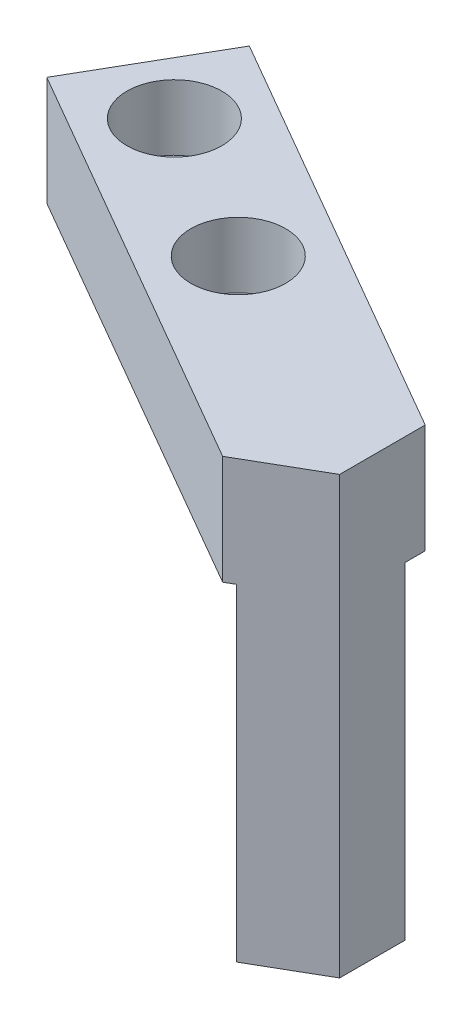
from build123d import *

# Parameters (mm, degrees)
EXTRUDE_1_DEPTH              = 5
EXTRUDE_2_DEPTH              = 15
HOLE_WIZARD_M2_1_D           = 2.35
HOLE_WIZARD_M2_1_DEPTH       = 20
HOLE_WIZARD_M2_1_CBORE_D     = 4.35
HOLE_WIZARD_M2_1_CBORE_DEPTH = 3


with BuildPart() as part:
    # 草圖1 → 填料-伸長1 (new body)
    with BuildSketch(Plane.XZ.offset(5)):
        Polygon((0, -3.92598183), (0, 0), (-3.4, 1.962990915), (-22.484609691, -9.055513627), (-19.084609691, -14.944486373), align=None)
    extrude(amount=-EXTRUDE_1_DEPTH)

    # 草圖2 → 填料-伸長2 (add)
    with BuildSketch(Plane.XZ.offset(5)):
        Polygon((0, -2.997949192), (-3, -2.997949192), (-3, 1.732050808), (0, 0), align=None)
    extrude(amount=EXTRUDE_2_DEPTH)

    # M2 六角頭機械螺釘的柱孔1
    with Locations(Plane(origin=(0, 0, 0), x_dir=(1, 0, 0), z_dir=(0, 1, 0))):
        with Locations((-10.998522628, 6.35), (-17.926725858, 10.35)):
            CounterBoreHole(HOLE_WIZARD_M2_1_D / 2, HOLE_WIZARD_M2_1_CBORE_D / 2, HOLE_WIZARD_M2_1_CBORE_DEPTH, depth=HOLE_WIZARD_M2_1_DEPTH)


solid = part.part
